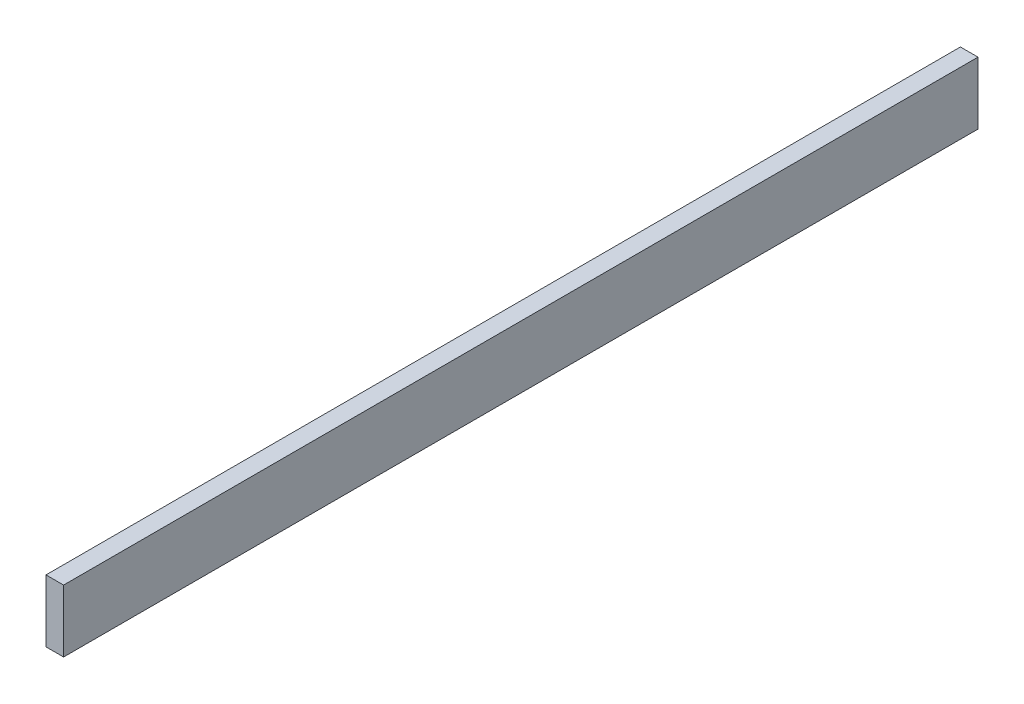
from build123d import *

# Parameters (mm, degrees)
SKETCH1_W                        = 12.7
SKETCH1_H                        = 45
CEK_1L_RAY_IC_PROFIL_SAG_1_DEPTH = 660


with BuildPart() as part:
    # Sketch1 → CEK_1L_ray_ic_profil_sag_1 (new body)
    with BuildSketch(Plane.XY):
        with Locations((611.65, 36.5)):
            Rectangle(SKETCH1_W, SKETCH1_H)
    extrude(amount=-CEK_1L_RAY_IC_PROFIL_SAG_1_DEPTH)


solid = part.part
